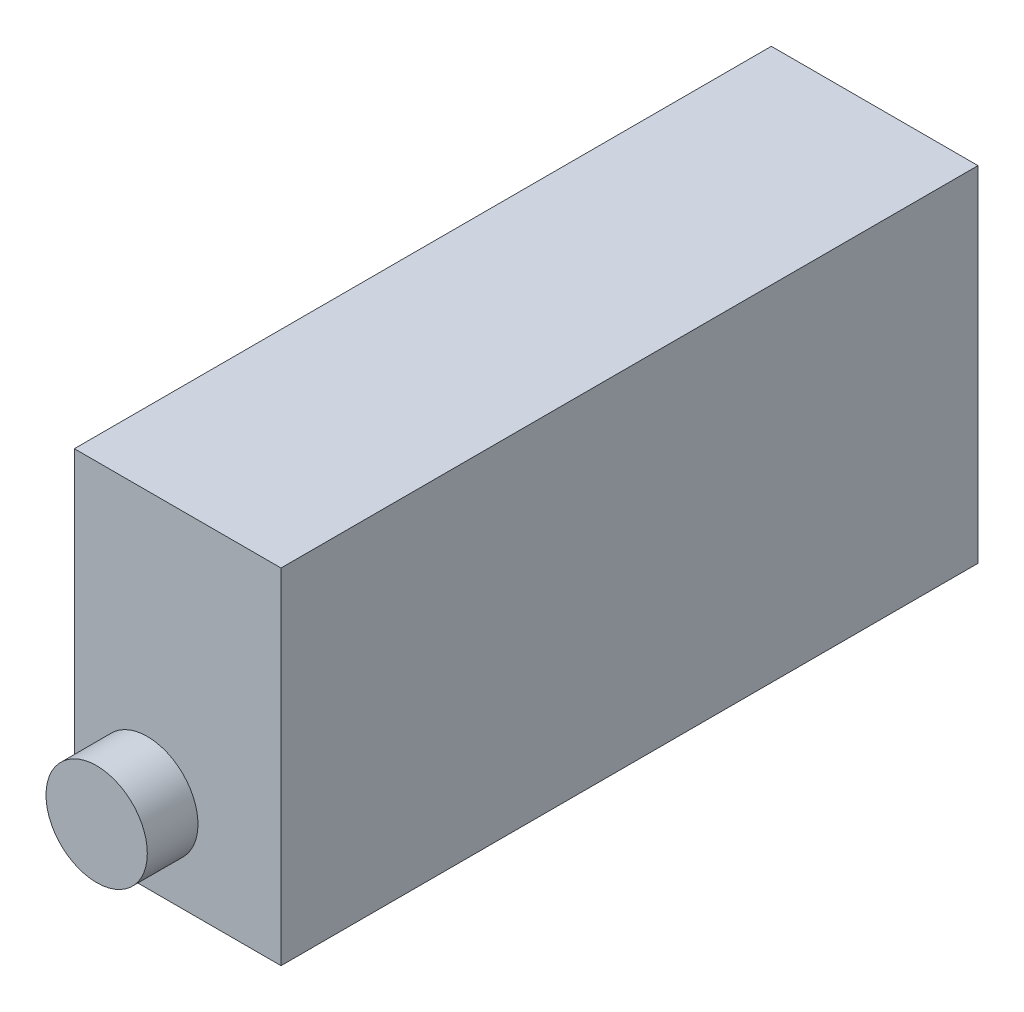
from build123d import *

# Parameters (mm, degrees)
SKETCH1_W           = 51
SKETCH1_H           = 85
BOSS_EXTRUDE1_DEPTH = 172
SKETCH3_R           = 12.5
BOSS_EXTRUDE2_DEPTH = 12.5


with BuildPart() as part:
    # Sketch1 → Boss-Extrude1 (new body)
    with BuildSketch(Plane.XY):
        Rectangle(SKETCH1_W, SKETCH1_H)
    extrude(amount=-BOSS_EXTRUDE1_DEPTH)

    # Sketch3 → Boss-Extrude2 (add)
    with BuildSketch(Plane.XY):
        with Locations(Location((-7.5, -22.5, 0), (0, 0, 180))):
            Circle(SKETCH3_R)
    extrude(amount=BOSS_EXTRUDE2_DEPTH)


solid = part.part
